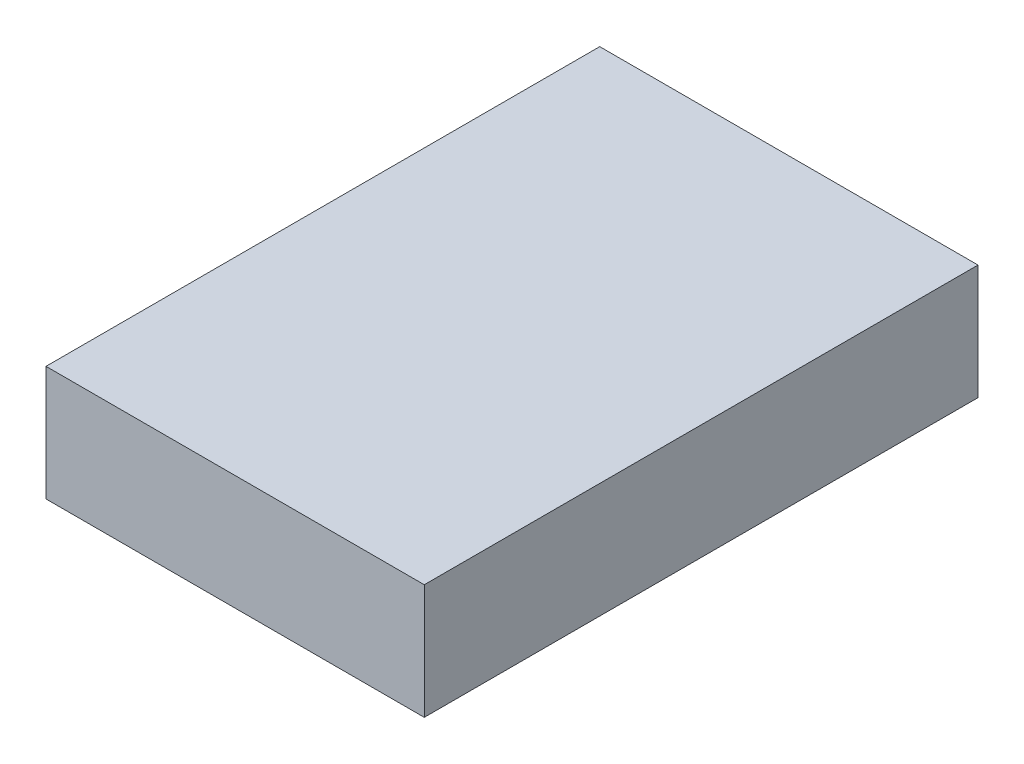
from build123d import *

# Parameters (mm, degrees)
SKETCH2_W           = 21.4122
SKETCH2_H           = 31.3436
BOSS_EXTRUDE1_DEPTH = 6.5024


with BuildPart() as part:
    # Sketch2 → Boss-Extrude1 (new body)
    with BuildSketch(Plane(origin=(0, 0, 0), x_dir=(1, 0, 0), z_dir=(0, 1, 0))):
        with Locations((10.7061, 15.6718)):
            Rectangle(SKETCH2_W, SKETCH2_H)
    extrude(amount=BOSS_EXTRUDE1_DEPTH)


solid = part.part
